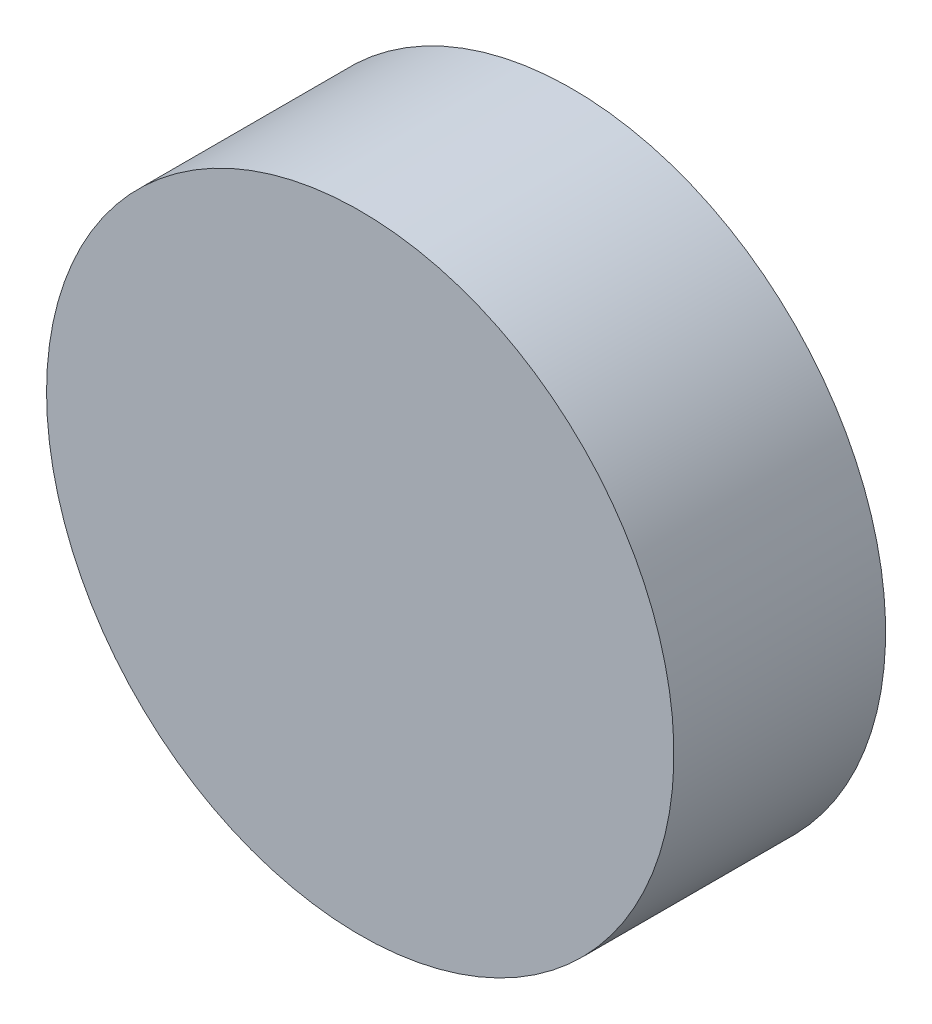
from build123d import *

# Parameters (mm, degrees)
CROQUIS1_R              = 2
SALIENTE_EXTRUIR1_DEPTH = 1.35


with BuildPart() as part:
    # Croquis1 → Saliente-Extruir1 (new body)
    with BuildSketch(Plane.XY):
        with Locations(Location((0, 0, 0), (0, 0, 180))):
            Circle(CROQUIS1_R)
    extrude(amount=SALIENTE_EXTRUIR1_DEPTH)


solid = part.part
